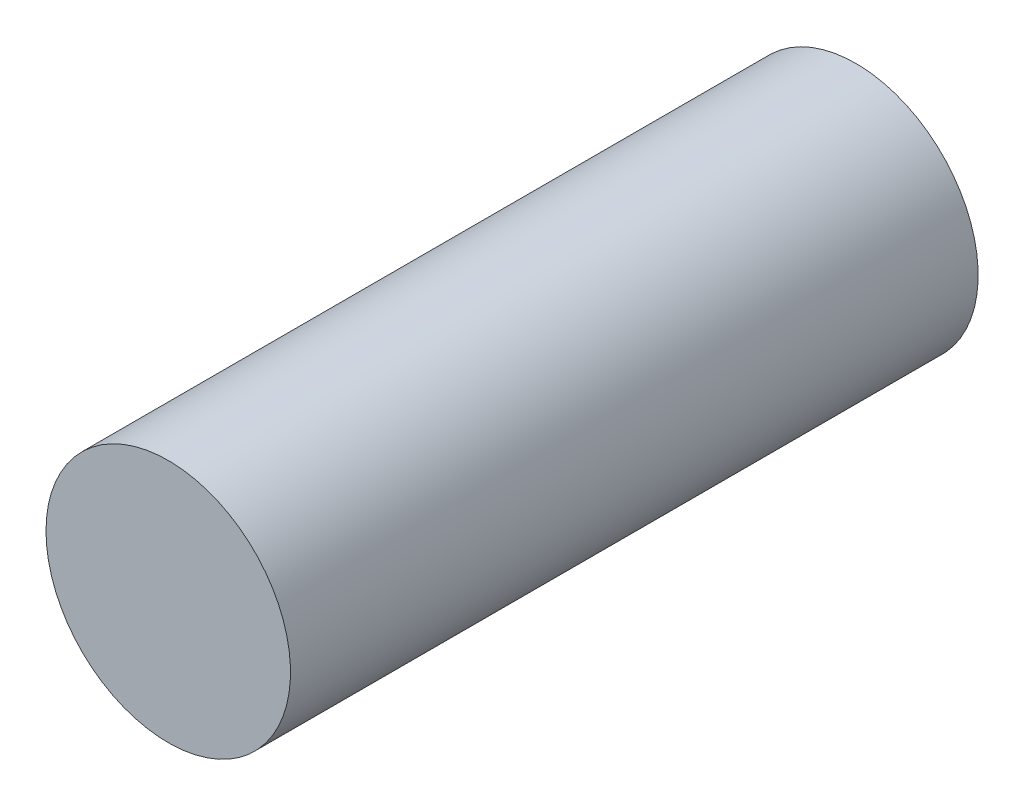
from build123d import *

# Parameters (mm, degrees)
SKETCH1_R           = 8
BOSS_EXTRUDE1_DEPTH = 45


with BuildPart() as part:
    # Sketch1 → Boss-Extrude1 (new body)
    with BuildSketch(Plane.XY):
        with Locations(Location((0, 0, 0), (0, 0, 180))):
            Circle(SKETCH1_R)
    extrude(amount=BOSS_EXTRUDE1_DEPTH)


solid = part.part
